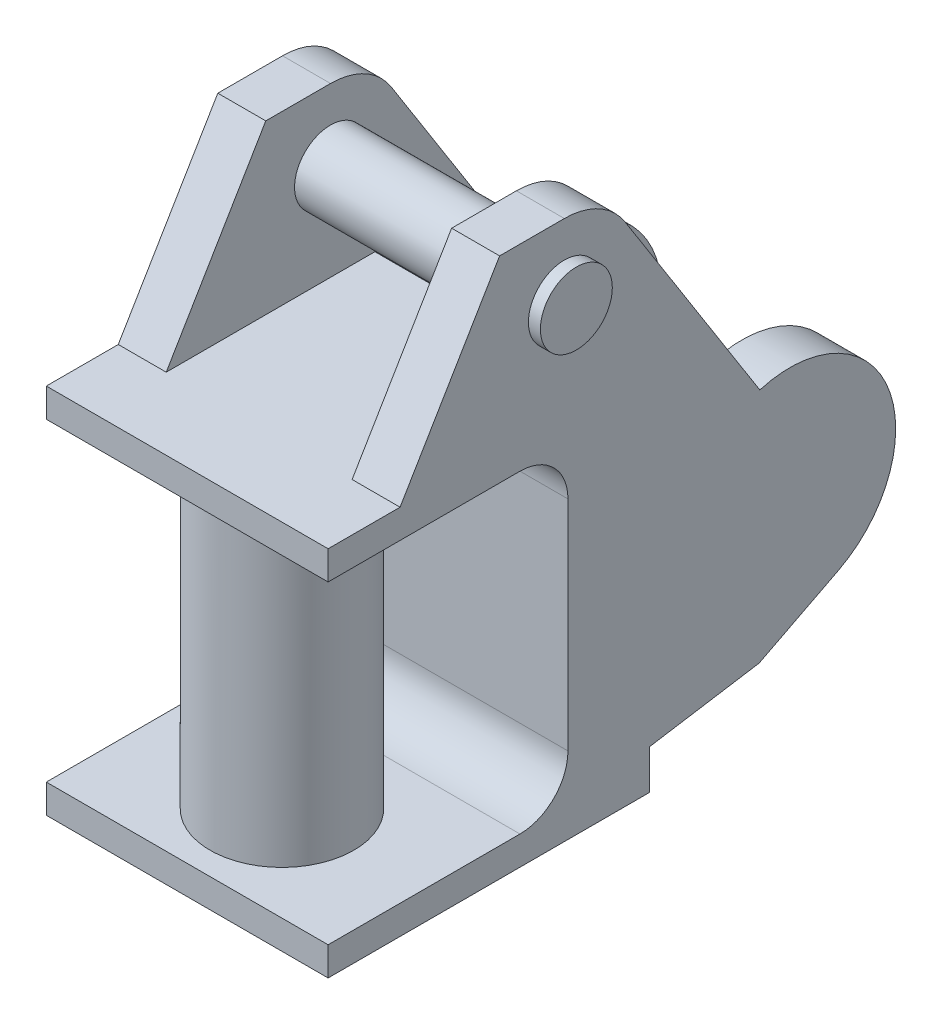
from build123d import *

# Parameters (mm, degrees)
SKETCH1_R           = 30
BOSS_EXTRUDE1_DEPTH = 40
BOSS_EXTRUDE2_DEPTH = 77.5
FILLET1_R           = 40
SKETCH3_R           = 30
BOSS_EXTRUDE3_DEPTH = 127.5
SKETCH4_R           = 20
BOSS_EXTRUDE4_DEPTH = 77.5
SKETCH5_R           = 60
BOSS_EXTRUDE5_DEPTH = 286


with BuildPart() as part:
    # Sketch1 → Boss-Extrude1 (new body)
    with BuildSketch(Plane(origin=(0, 0, 0), x_dir=(0, 0, -1), z_dir=(1, 0, 0))):
        with BuildLine():
            Line((0, 0), (268, 0))
            Line((268, 0), (268, 33))
            Line((268, 33), (359.392375101, 47.67597271))
            Line((359.392375101, 47.67597271), (425.254709277, 81.41249501))
            ThreePointArc((425.254709277, 81.41249501), (466.993732625, 192.763781371), (360.011718162, 244.687799182))
            Line((360.011718162, 244.687799182), (247.694370572, 422.094871744))
            ThreePointArc((247.694370572, 422.094871744), (225.933611038, 442.562782958), (197, 450))
            Line((197, 450), (143, 450))
            Line((143, 450), (60, 310))
            Line((60, 310), (0, 310))
            Line((0, 310), (0, 286))
            Line((0, 286), (200, 286))
            Line((200, 286), (200, 24))
            Line((200, 24), (0, 24))
            Line((0, 24), (0, 0))
        make_face()
        with Locations((197, 390)):
            Circle(SKETCH1_R, mode=Mode.SUBTRACT)
    extrude(amount=BOSS_EXTRUDE1_DEPTH)


with BuildPart() as body_2:
    # Mirror3: mirrored copy
    add(part.part.mirror(Plane(origin=(-77.5, 0, 0), x_dir=(0, 0, 1), z_dir=(1, 0, 0))))


with BuildPart() as part_1:
    add(part.part)

    add(body_2.part)  # Boss-Extrude2 merges body 2
    # Sketch2 → Boss-Extrude2 (add, symmetric)
    with BuildSketch(Plane(origin=(-77.5, 0, 0), x_dir=(0, 0, -1), z_dir=(1, 0, 0))):
        Polygon((0, 0), (234, 0), (234, 310), (0, 310), (0, 286), (200, 286), (200, 24), (0, 24), align=None)
    extrude(amount=BOSS_EXTRUDE2_DEPTH, both=True)

    # Fillet1
    fillet1_edges = [part_1.edges().sort_by_distance(p)[0] for p in [
        (-77.5, 24, -200),
        (-77.5, 286, -200),
    ]]
    fillet(fillet1_edges, radius=FILLET1_R)

    # Sketch3 → Boss-Extrude3 (add, symmetric)
    with BuildSketch(Plane(origin=(-77.5, 0, 0), x_dir=(0, 0, -1), z_dir=(1, 0, 0))):
        with Locations((197, 390)):
            Circle(SKETCH3_R)
    extrude(amount=BOSS_EXTRUDE3_DEPTH, both=True)

    # Sketch5 → Boss-Extrude5 (add)
    with BuildSketch(Plane(origin=(0, 0, 0), x_dir=(1, 0, 0), z_dir=(0, 1, 0))):
        with Locations(Location((-77.5, 79, 0), (0, 0, 90))):
            Circle(SKETCH5_R)
    extrude(amount=BOSS_EXTRUDE5_DEPTH)


with BuildPart() as body_2_2:
    # Sketch4 → Boss-Extrude4 (new, symmetric)
    with BuildSketch(Plane(origin=(-77.5, 0, 0), x_dir=(0, 0, -1), z_dir=(1, 0, 0))):
        with Locations((385, 160)):
            Circle(SKETCH4_R)
    extrude(amount=BOSS_EXTRUDE4_DEPTH, both=True)


solid = Compound([part_1.part, body_2_2.part])
